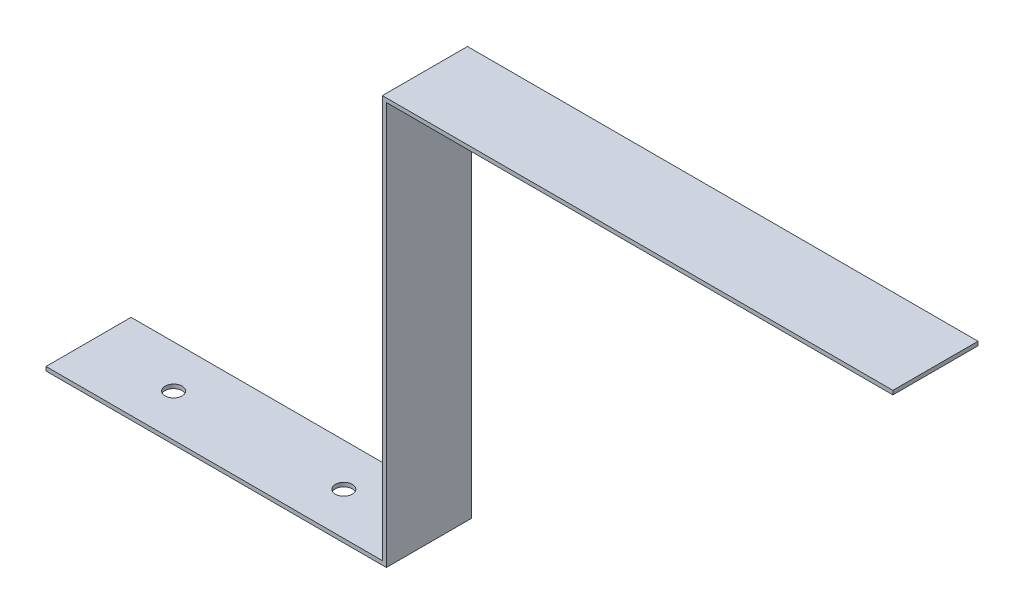
from build123d import *

# Parameters (mm, degrees)
BOSS_EXTRUDE1_DEPTH = 15
SKETCH2_R           = 1.5
CUT_EXTRUDE1_DEPTH  = 167.001475897


with BuildPart() as part:
    # Sketch1 → Boss-Extrude1 (new body)
    with BuildSketch(Plane.XY):
        Polygon((0, 0), (60, 0), (60, 71), (149.3, 71), (149.3, 71.7), (59.3, 71.7), (59.3, 0.7), (0, 0.7), align=None)
    extrude(amount=BOSS_EXTRUDE1_DEPTH)

    # Sketch2 → Cut-Extrude1 (cut, through all)
    with BuildSketch(Plane(origin=(0, 0.7, 0), x_dir=(1, 0, 0), z_dir=(0, 1, 0))):
        with Locations(Location((15, -7.5, 0), (0, 0, 180))):
            Circle(SKETCH2_R)
        with Locations(Location((45, -7.5, 0), (0, 0, 180))):
            Circle(SKETCH2_R)
    extrude(amount=-CUT_EXTRUDE1_DEPTH, mode=Mode.SUBTRACT)


solid = part.part
